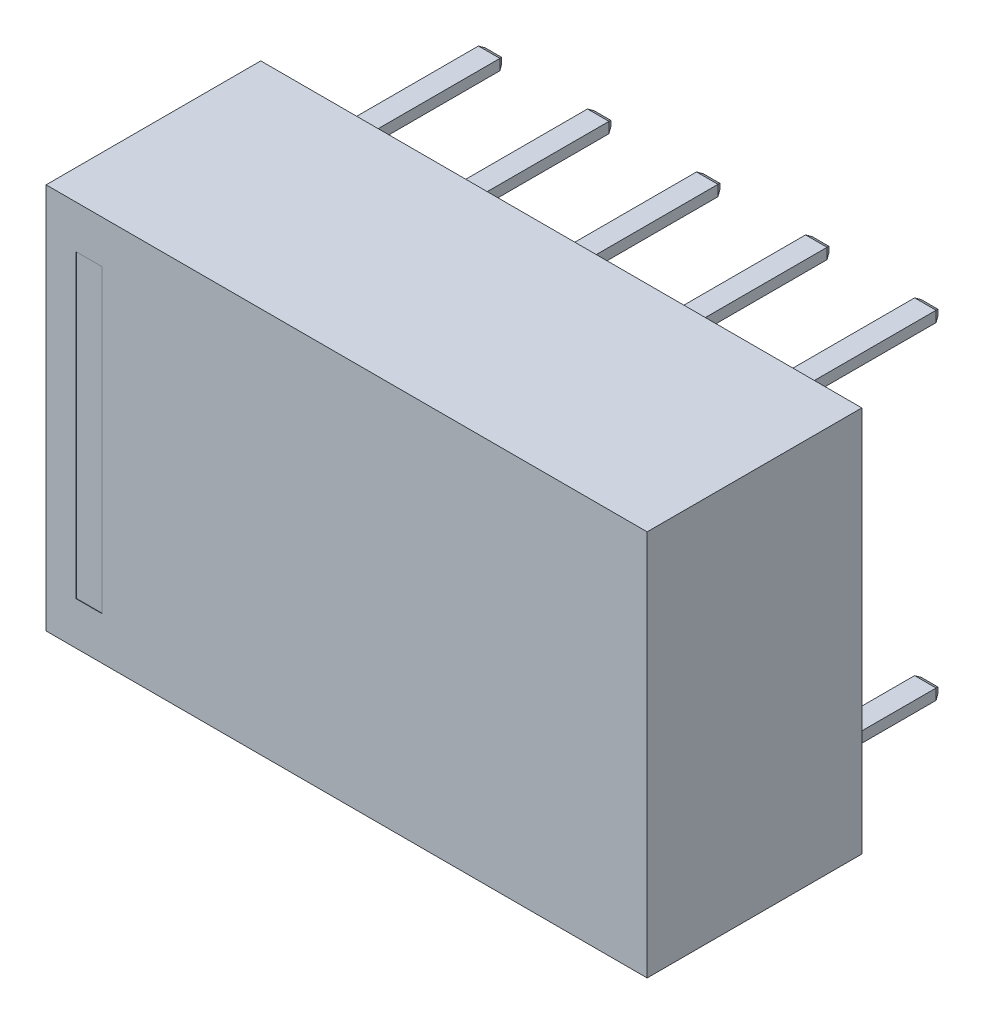
from build123d import *
from OCP.BRepFilletAPI import BRepFilletAPI_MakeChamfer

# Parameters (mm, degrees)
SKETCH_1_W                          = 14
SKETCH_1_H                          = 9
EXTRUDE_1_DEPTH                     = 5
SKETCH_3_W                          = 0.6
SKETCH_3_H                          = 7
CUT_EXTRUDE_1_DEPTH                 = 0.01
SKETCH_4_W                          = 0.5
SKETCH_4_H                          = 0.25
EXTRUDE_2_DEPTH                     = 3.5
CHAMFER_1_SIZE                      = 0.1
CHAMFER_1_SIZE2                     = 0.057735027
PATTERN_LINEAR_1_COUNT              = 5
PATTERN_LINEAR_1_PITCH              = 2.54
PATTERN_LINEAR_1_COUNT_DIR2         = 2
PATTERN_LINEAR_1_PITCH_DIR2         = 7.62
CHAMFER_1_OF_PATTERN_LINEAR_1_SIZE  = 0.1
CHAMFER_1_OF_PATTERN_LINEAR_1_SIZE2 = 0.057735027


with BuildPart() as part:
    # Эскиз1 → Бобышка-Вытянуть1 (new body)
    with BuildSketch(Plane.XY):
        Rectangle(SKETCH_1_W, SKETCH_1_H)
    extrude(amount=EXTRUDE_1_DEPTH)

    # Эскиз3 → Вырез-Вытянуть1 (cut)
    with BuildSketch(Plane.XY.offset(5)):
        with Locations((-6, 0)):
            Rectangle(SKETCH_3_W, SKETCH_3_H)
    extrude(amount=-CUT_EXTRUDE_1_DEPTH, mode=Mode.SUBTRACT)

    # Эскиз4 → Бобышка-Вытянуть2 (add)
    with BuildSketch(Plane(origin=(0, 0, 0), x_dir=(-1, 0, 0), z_dir=(0, 0, -1))):
        with Locations((5.08, -3.81)):
            Rectangle(SKETCH_4_W, SKETCH_4_H)
    extrude_2 = extrude(amount=EXTRUDE_2_DEPTH)

    # Фаска1: one chamfer whose edges measure the first distance from different faces: ONE call of the kernel's chamfer builder (chamfer() names one face for all edges)
    chamfer_1_edges_1 = [part.edges().sort_by_distance(p)[0] for p in [
        (-4.83, -3.81, -3.5),
    ]]
    chamfer_1_side_1 = [part.faces().sort_by_distance(p)[0] for p in [
        (-4.83, -3.81, -1.75),
    ]]
    chamfer_1_edges_2 = [part.edges().sort_by_distance(p)[0] for p in [
        (-5.08, -3.935, -3.5),
    ]]
    chamfer_1_side_2 = [part.faces().sort_by_distance(p)[0] for p in [
        (-5.08, -3.935, -1.75),
    ]]
    chamfer_1_edges_3 = [part.edges().sort_by_distance(p)[0] for p in [
        (-5.33, -3.81, -3.5),
    ]]
    chamfer_1_side_3 = [part.faces().sort_by_distance(p)[0] for p in [
        (-5.33, -3.81, -1.75),
    ]]
    chamfer_1_edges_4 = [part.edges().sort_by_distance(p)[0] for p in [
        (-5.08, -3.685, -3.5),
    ]]
    chamfer_1_side_4 = [part.faces().sort_by_distance(p)[0] for p in [
        (-5.08, -3.685, -1.75),
    ]]
    chamfer_1 = BRepFilletAPI_MakeChamfer(part.part.solid().wrapped)
    for e in chamfer_1_edges_1:
        chamfer_1.Add(CHAMFER_1_SIZE, CHAMFER_1_SIZE2, e.wrapped, chamfer_1_side_1[0].wrapped)  # the first distance lies on this face
    for e in chamfer_1_edges_2:
        chamfer_1.Add(CHAMFER_1_SIZE, CHAMFER_1_SIZE2, e.wrapped, chamfer_1_side_2[0].wrapped)  # the first distance lies on this face
    for e in chamfer_1_edges_3:
        chamfer_1.Add(CHAMFER_1_SIZE, CHAMFER_1_SIZE2, e.wrapped, chamfer_1_side_3[0].wrapped)  # the first distance lies on this face
    for e in chamfer_1_edges_4:
        chamfer_1.Add(CHAMFER_1_SIZE, CHAMFER_1_SIZE2, e.wrapped, chamfer_1_side_4[0].wrapped)  # the first distance lies on this face
    add(Compound.cast(chamfer_1.Shape()), mode=Mode.REPLACE)

    # Линейный массив1: Extrude 2 5 × 2
    with Locations(*[(i * PATTERN_LINEAR_1_PITCH, j * PATTERN_LINEAR_1_PITCH_DIR2, 0) for i in range(PATTERN_LINEAR_1_COUNT) for j in range(PATTERN_LINEAR_1_COUNT_DIR2) if (i, j) != (0, 0)]):
        add(extrude_2)

    # Фаска1 of Линейный массив1: one chamfer whose edges measure the first distance from different faces: ONE call of the kernel's chamfer builder (chamfer() names one face for all edges)
    chamfer_1_of_pattern_linear_1_edges_1 = [part.edges().sort_by_distance(p)[0] for p in [
        (-4.83, 3.81, -3.5),
    ]]
    chamfer_1_of_pattern_linear_1_side_1 = [part.faces().sort_by_distance(p)[0] for p in [
        (-4.83, 3.81, -1.75),
    ]]
    chamfer_1_of_pattern_linear_1_edges_2 = [part.edges().sort_by_distance(p)[0] for p in [
        (-5.08, 3.685, -3.5),
    ]]
    chamfer_1_of_pattern_linear_1_side_2 = [part.faces().sort_by_distance(p)[0] for p in [
        (-5.08, 3.685, -1.75),
    ]]
    chamfer_1_of_pattern_linear_1_edges_3 = [part.edges().sort_by_distance(p)[0] for p in [
        (-5.33, 3.81, -3.5),
    ]]
    chamfer_1_of_pattern_linear_1_side_3 = [part.faces().sort_by_distance(p)[0] for p in [
        (-5.33, 3.81, -1.75),
    ]]
    chamfer_1_of_pattern_linear_1_edges_4 = [part.edges().sort_by_distance(p)[0] for p in [
        (-5.08, 3.935, -3.5),
    ]]
    chamfer_1_of_pattern_linear_1_side_4 = [part.faces().sort_by_distance(p)[0] for p in [
        (-5.08, 3.935, -1.75),
    ]]
    chamfer_1_of_pattern_linear_1_edges_5 = [part.edges().sort_by_distance(p)[0] for p in [
        (-2.29, -3.81, -3.5),
    ]]
    chamfer_1_of_pattern_linear_1_side_5 = [part.faces().sort_by_distance(p)[0] for p in [
        (-2.29, -3.81, -1.75),
    ]]
    chamfer_1_of_pattern_linear_1_edges_6 = [part.edges().sort_by_distance(p)[0] for p in [
        (-2.54, -3.935, -3.5),
    ]]
    chamfer_1_of_pattern_linear_1_side_6 = [part.faces().sort_by_distance(p)[0] for p in [
        (-2.54, -3.935, -1.75),
    ]]
    chamfer_1_of_pattern_linear_1_edges_7 = [part.edges().sort_by_distance(p)[0] for p in [
        (-2.79, -3.81, -3.5),
    ]]
    chamfer_1_of_pattern_linear_1_side_7 = [part.faces().sort_by_distance(p)[0] for p in [
        (-2.79, -3.81, -1.75),
    ]]
    chamfer_1_of_pattern_linear_1_edges_8 = [part.edges().sort_by_distance(p)[0] for p in [
        (-2.54, -3.685, -3.5),
    ]]
    chamfer_1_of_pattern_linear_1_side_8 = [part.faces().sort_by_distance(p)[0] for p in [
        (-2.54, -3.685, -1.75),
    ]]
    chamfer_1_of_pattern_linear_1_edges_9 = [part.edges().sort_by_distance(p)[0] for p in [
        (-2.29, 3.81, -3.5),
    ]]
    chamfer_1_of_pattern_linear_1_side_9 = [part.faces().sort_by_distance(p)[0] for p in [
        (-2.29, 3.81, -1.75),
    ]]
    chamfer_1_of_pattern_linear_1_edges_10 = [part.edges().sort_by_distance(p)[0] for p in [
        (-2.54, 3.685, -3.5),
    ]]
    chamfer_1_of_pattern_linear_1_side_10 = [part.faces().sort_by_distance(p)[0] for p in [
        (-2.54, 3.685, -1.75),
    ]]
    chamfer_1_of_pattern_linear_1_edges_11 = [part.edges().sort_by_distance(p)[0] for p in [
        (-2.79, 3.81, -3.5),
    ]]
    chamfer_1_of_pattern_linear_1_side_11 = [part.faces().sort_by_distance(p)[0] for p in [
        (-2.79, 3.81, -1.75),
    ]]
    chamfer_1_of_pattern_linear_1_edges_12 = [part.edges().sort_by_distance(p)[0] for p in [
        (-2.54, 3.935, -3.5),
    ]]
    chamfer_1_of_pattern_linear_1_side_12 = [part.faces().sort_by_distance(p)[0] for p in [
        (-2.54, 3.935, -1.75),
    ]]
    chamfer_1_of_pattern_linear_1_edges_13 = [part.edges().sort_by_distance(p)[0] for p in [
        (0.25, -3.81, -3.5),
    ]]
    chamfer_1_of_pattern_linear_1_side_13 = [part.faces().sort_by_distance(p)[0] for p in [
        (0.25, -3.81, -1.75),
    ]]
    chamfer_1_of_pattern_linear_1_edges_14 = [part.edges().sort_by_distance(p)[0] for p in [
        (0, -3.935, -3.5),
    ]]
    chamfer_1_of_pattern_linear_1_side_14 = [part.faces().sort_by_distance(p)[0] for p in [
        (0, -3.935, -1.75),
    ]]
    chamfer_1_of_pattern_linear_1_edges_15 = [part.edges().sort_by_distance(p)[0] for p in [
        (-0.25, -3.81, -3.5),
    ]]
    chamfer_1_of_pattern_linear_1_side_15 = [part.faces().sort_by_distance(p)[0] for p in [
        (-0.25, -3.81, -1.75),
    ]]
    chamfer_1_of_pattern_linear_1_edges_16 = [part.edges().sort_by_distance(p)[0] for p in [
        (0, -3.685, -3.5),
    ]]
    chamfer_1_of_pattern_linear_1_side_16 = [part.faces().sort_by_distance(p)[0] for p in [
        (0, -3.685, -1.75),
    ]]
    chamfer_1_of_pattern_linear_1_edges_17 = [part.edges().sort_by_distance(p)[0] for p in [
        (0.25, 3.81, -3.5),
    ]]
    chamfer_1_of_pattern_linear_1_side_17 = [part.faces().sort_by_distance(p)[0] for p in [
        (0.25, 3.81, -1.75),
    ]]
    chamfer_1_of_pattern_linear_1_edges_18 = [part.edges().sort_by_distance(p)[0] for p in [
        (0, 3.685, -3.5),
    ]]
    chamfer_1_of_pattern_linear_1_side_18 = [part.faces().sort_by_distance(p)[0] for p in [
        (0, 3.685, -1.75),
    ]]
    chamfer_1_of_pattern_linear_1_edges_19 = [part.edges().sort_by_distance(p)[0] for p in [
        (-0.25, 3.81, -3.5),
    ]]
    chamfer_1_of_pattern_linear_1_side_19 = [part.faces().sort_by_distance(p)[0] for p in [
        (-0.25, 3.81, -1.75),
    ]]
    chamfer_1_of_pattern_linear_1_edges_20 = [part.edges().sort_by_distance(p)[0] for p in [
        (0, 3.935, -3.5),
    ]]
    chamfer_1_of_pattern_linear_1_side_20 = [part.faces().sort_by_distance(p)[0] for p in [
        (0, 3.935, -1.75),
    ]]
    chamfer_1_of_pattern_linear_1_edges_21 = [part.edges().sort_by_distance(p)[0] for p in [
        (2.79, -3.81, -3.5),
    ]]
    chamfer_1_of_pattern_linear_1_side_21 = [part.faces().sort_by_distance(p)[0] for p in [
        (2.79, -3.81, -1.75),
    ]]
    chamfer_1_of_pattern_linear_1_edges_22 = [part.edges().sort_by_distance(p)[0] for p in [
        (2.54, -3.935, -3.5),
    ]]
    chamfer_1_of_pattern_linear_1_side_22 = [part.faces().sort_by_distance(p)[0] for p in [
        (2.54, -3.935, -1.75),
    ]]
    chamfer_1_of_pattern_linear_1_edges_23 = [part.edges().sort_by_distance(p)[0] for p in [
        (2.29, -3.81, -3.5),
    ]]
    chamfer_1_of_pattern_linear_1_side_23 = [part.faces().sort_by_distance(p)[0] for p in [
        (2.29, -3.81, -1.75),
    ]]
    chamfer_1_of_pattern_linear_1_edges_24 = [part.edges().sort_by_distance(p)[0] for p in [
        (2.54, -3.685, -3.5),
    ]]
    chamfer_1_of_pattern_linear_1_side_24 = [part.faces().sort_by_distance(p)[0] for p in [
        (2.54, -3.685, -1.75),
    ]]
    chamfer_1_of_pattern_linear_1_edges_25 = [part.edges().sort_by_distance(p)[0] for p in [
        (2.79, 3.81, -3.5),
    ]]
    chamfer_1_of_pattern_linear_1_side_25 = [part.faces().sort_by_distance(p)[0] for p in [
        (2.79, 3.81, -1.75),
    ]]
    chamfer_1_of_pattern_linear_1_edges_26 = [part.edges().sort_by_distance(p)[0] for p in [
        (2.54, 3.685, -3.5),
    ]]
    chamfer_1_of_pattern_linear_1_side_26 = [part.faces().sort_by_distance(p)[0] for p in [
        (2.54, 3.685, -1.75),
    ]]
    chamfer_1_of_pattern_linear_1_edges_27 = [part.edges().sort_by_distance(p)[0] for p in [
        (2.29, 3.81, -3.5),
    ]]
    chamfer_1_of_pattern_linear_1_side_27 = [part.faces().sort_by_distance(p)[0] for p in [
        (2.29, 3.81, -1.75),
    ]]
    chamfer_1_of_pattern_linear_1_edges_28 = [part.edges().sort_by_distance(p)[0] for p in [
        (2.54, 3.935, -3.5),
    ]]
    chamfer_1_of_pattern_linear_1_side_28 = [part.faces().sort_by_distance(p)[0] for p in [
        (2.54, 3.935, -1.75),
    ]]
    chamfer_1_of_pattern_linear_1_edges_29 = [part.edges().sort_by_distance(p)[0] for p in [
        (5.33, -3.81, -3.5),
    ]]
    chamfer_1_of_pattern_linear_1_side_29 = [part.faces().sort_by_distance(p)[0] for p in [
        (5.33, -3.81, -1.75),
    ]]
    chamfer_1_of_pattern_linear_1_edges_30 = [part.edges().sort_by_distance(p)[0] for p in [
        (5.08, -3.935, -3.5),
    ]]
    chamfer_1_of_pattern_linear_1_side_30 = [part.faces().sort_by_distance(p)[0] for p in [
        (5.08, -3.935, -1.75),
    ]]
    chamfer_1_of_pattern_linear_1_edges_31 = [part.edges().sort_by_distance(p)[0] for p in [
        (4.83, -3.81, -3.5),
    ]]
    chamfer_1_of_pattern_linear_1_side_31 = [part.faces().sort_by_distance(p)[0] for p in [
        (4.83, -3.81, -1.75),
    ]]
    chamfer_1_of_pattern_linear_1_edges_32 = [part.edges().sort_by_distance(p)[0] for p in [
        (5.08, -3.685, -3.5),
    ]]
    chamfer_1_of_pattern_linear_1_side_32 = [part.faces().sort_by_distance(p)[0] for p in [
        (5.08, -3.685, -1.75),
    ]]
    chamfer_1_of_pattern_linear_1_edges_33 = [part.edges().sort_by_distance(p)[0] for p in [
        (5.33, 3.81, -3.5),
    ]]
    chamfer_1_of_pattern_linear_1_side_33 = [part.faces().sort_by_distance(p)[0] for p in [
        (5.33, 3.81, -1.75),
    ]]
    chamfer_1_of_pattern_linear_1_edges_34 = [part.edges().sort_by_distance(p)[0] for p in [
        (5.08, 3.685, -3.5),
    ]]
    chamfer_1_of_pattern_linear_1_side_34 = [part.faces().sort_by_distance(p)[0] for p in [
        (5.08, 3.685, -1.75),
    ]]
    chamfer_1_of_pattern_linear_1_edges_35 = [part.edges().sort_by_distance(p)[0] for p in [
        (4.83, 3.81, -3.5),
    ]]
    chamfer_1_of_pattern_linear_1_side_35 = [part.faces().sort_by_distance(p)[0] for p in [
        (4.83, 3.81, -1.75),
    ]]
    chamfer_1_of_pattern_linear_1_edges_36 = [part.edges().sort_by_distance(p)[0] for p in [
        (5.08, 3.935, -3.5),
    ]]
    chamfer_1_of_pattern_linear_1_side_36 = [part.faces().sort_by_distance(p)[0] for p in [
        (5.08, 3.935, -1.75),
    ]]
    chamfer_1_of_pattern_linear_1 = BRepFilletAPI_MakeChamfer(part.part.solid().wrapped)
    for e in chamfer_1_of_pattern_linear_1_edges_1:
        chamfer_1_of_pattern_linear_1.Add(CHAMFER_1_OF_PATTERN_LINEAR_1_SIZE, CHAMFER_1_OF_PATTERN_LINEAR_1_SIZE2, e.wrapped, chamfer_1_of_pattern_linear_1_side_1[0].wrapped)  # the first distance lies on this face
    for e in chamfer_1_of_pattern_linear_1_edges_2:
        chamfer_1_of_pattern_linear_1.Add(CHAMFER_1_OF_PATTERN_LINEAR_1_SIZE, CHAMFER_1_OF_PATTERN_LINEAR_1_SIZE2, e.wrapped, chamfer_1_of_pattern_linear_1_side_2[0].wrapped)  # the first distance lies on this face
    for e in chamfer_1_of_pattern_linear_1_edges_3:
        chamfer_1_of_pattern_linear_1.Add(CHAMFER_1_OF_PATTERN_LINEAR_1_SIZE, CHAMFER_1_OF_PATTERN_LINEAR_1_SIZE2, e.wrapped, chamfer_1_of_pattern_linear_1_side_3[0].wrapped)  # the first distance lies on this face
    for e in chamfer_1_of_pattern_linear_1_edges_4:
        chamfer_1_of_pattern_linear_1.Add(CHAMFER_1_OF_PATTERN_LINEAR_1_SIZE, CHAMFER_1_OF_PATTERN_LINEAR_1_SIZE2, e.wrapped, chamfer_1_of_pattern_linear_1_side_4[0].wrapped)  # the first distance lies on this face
    for e in chamfer_1_of_pattern_linear_1_edges_5:
        chamfer_1_of_pattern_linear_1.Add(CHAMFER_1_OF_PATTERN_LINEAR_1_SIZE, CHAMFER_1_OF_PATTERN_LINEAR_1_SIZE2, e.wrapped, chamfer_1_of_pattern_linear_1_side_5[0].wrapped)  # the first distance lies on this face
    for e in chamfer_1_of_pattern_linear_1_edges_6:
        chamfer_1_of_pattern_linear_1.Add(CHAMFER_1_OF_PATTERN_LINEAR_1_SIZE, CHAMFER_1_OF_PATTERN_LINEAR_1_SIZE2, e.wrapped, chamfer_1_of_pattern_linear_1_side_6[0].wrapped)  # the first distance lies on this face
    for e in chamfer_1_of_pattern_linear_1_edges_7:
        chamfer_1_of_pattern_linear_1.Add(CHAMFER_1_OF_PATTERN_LINEAR_1_SIZE, CHAMFER_1_OF_PATTERN_LINEAR_1_SIZE2, e.wrapped, chamfer_1_of_pattern_linear_1_side_7[0].wrapped)  # the first distance lies on this face
    for e in chamfer_1_of_pattern_linear_1_edges_8:
        chamfer_1_of_pattern_linear_1.Add(CHAMFER_1_OF_PATTERN_LINEAR_1_SIZE, CHAMFER_1_OF_PATTERN_LINEAR_1_SIZE2, e.wrapped, chamfer_1_of_pattern_linear_1_side_8[0].wrapped)  # the first distance lies on this face
    for e in chamfer_1_of_pattern_linear_1_edges_9:
        chamfer_1_of_pattern_linear_1.Add(CHAMFER_1_OF_PATTERN_LINEAR_1_SIZE, CHAMFER_1_OF_PATTERN_LINEAR_1_SIZE2, e.wrapped, chamfer_1_of_pattern_linear_1_side_9[0].wrapped)  # the first distance lies on this face
    for e in chamfer_1_of_pattern_linear_1_edges_10:
        chamfer_1_of_pattern_linear_1.Add(CHAMFER_1_OF_PATTERN_LINEAR_1_SIZE, CHAMFER_1_OF_PATTERN_LINEAR_1_SIZE2, e.wrapped, chamfer_1_of_pattern_linear_1_side_10[0].wrapped)  # the first distance lies on this face
    for e in chamfer_1_of_pattern_linear_1_edges_11:
        chamfer_1_of_pattern_linear_1.Add(CHAMFER_1_OF_PATTERN_LINEAR_1_SIZE, CHAMFER_1_OF_PATTERN_LINEAR_1_SIZE2, e.wrapped, chamfer_1_of_pattern_linear_1_side_11[0].wrapped)  # the first distance lies on this face
    for e in chamfer_1_of_pattern_linear_1_edges_12:
        chamfer_1_of_pattern_linear_1.Add(CHAMFER_1_OF_PATTERN_LINEAR_1_SIZE, CHAMFER_1_OF_PATTERN_LINEAR_1_SIZE2, e.wrapped, chamfer_1_of_pattern_linear_1_side_12[0].wrapped)  # the first distance lies on this face
    for e in chamfer_1_of_pattern_linear_1_edges_13:
        chamfer_1_of_pattern_linear_1.Add(CHAMFER_1_OF_PATTERN_LINEAR_1_SIZE, CHAMFER_1_OF_PATTERN_LINEAR_1_SIZE2, e.wrapped, chamfer_1_of_pattern_linear_1_side_13[0].wrapped)  # the first distance lies on this face
    for e in chamfer_1_of_pattern_linear_1_edges_14:
        chamfer_1_of_pattern_linear_1.Add(CHAMFER_1_OF_PATTERN_LINEAR_1_SIZE, CHAMFER_1_OF_PATTERN_LINEAR_1_SIZE2, e.wrapped, chamfer_1_of_pattern_linear_1_side_14[0].wrapped)  # the first distance lies on this face
    for e in chamfer_1_of_pattern_linear_1_edges_15:
        chamfer_1_of_pattern_linear_1.Add(CHAMFER_1_OF_PATTERN_LINEAR_1_SIZE, CHAMFER_1_OF_PATTERN_LINEAR_1_SIZE2, e.wrapped, chamfer_1_of_pattern_linear_1_side_15[0].wrapped)  # the first distance lies on this face
    for e in chamfer_1_of_pattern_linear_1_edges_16:
        chamfer_1_of_pattern_linear_1.Add(CHAMFER_1_OF_PATTERN_LINEAR_1_SIZE, CHAMFER_1_OF_PATTERN_LINEAR_1_SIZE2, e.wrapped, chamfer_1_of_pattern_linear_1_side_16[0].wrapped)  # the first distance lies on this face
    for e in chamfer_1_of_pattern_linear_1_edges_17:
        chamfer_1_of_pattern_linear_1.Add(CHAMFER_1_OF_PATTERN_LINEAR_1_SIZE, CHAMFER_1_OF_PATTERN_LINEAR_1_SIZE2, e.wrapped, chamfer_1_of_pattern_linear_1_side_17[0].wrapped)  # the first distance lies on this face
    for e in chamfer_1_of_pattern_linear_1_edges_18:
        chamfer_1_of_pattern_linear_1.Add(CHAMFER_1_OF_PATTERN_LINEAR_1_SIZE, CHAMFER_1_OF_PATTERN_LINEAR_1_SIZE2, e.wrapped, chamfer_1_of_pattern_linear_1_side_18[0].wrapped)  # the first distance lies on this face
    for e in chamfer_1_of_pattern_linear_1_edges_19:
        chamfer_1_of_pattern_linear_1.Add(CHAMFER_1_OF_PATTERN_LINEAR_1_SIZE, CHAMFER_1_OF_PATTERN_LINEAR_1_SIZE2, e.wrapped, chamfer_1_of_pattern_linear_1_side_19[0].wrapped)  # the first distance lies on this face
    for e in chamfer_1_of_pattern_linear_1_edges_20:
        chamfer_1_of_pattern_linear_1.Add(CHAMFER_1_OF_PATTERN_LINEAR_1_SIZE, CHAMFER_1_OF_PATTERN_LINEAR_1_SIZE2, e.wrapped, chamfer_1_of_pattern_linear_1_side_20[0].wrapped)  # the first distance lies on this face
    for e in chamfer_1_of_pattern_linear_1_edges_21:
        chamfer_1_of_pattern_linear_1.Add(CHAMFER_1_OF_PATTERN_LINEAR_1_SIZE, CHAMFER_1_OF_PATTERN_LINEAR_1_SIZE2, e.wrapped, chamfer_1_of_pattern_linear_1_side_21[0].wrapped)  # the first distance lies on this face
    for e in chamfer_1_of_pattern_linear_1_edges_22:
        chamfer_1_of_pattern_linear_1.Add(CHAMFER_1_OF_PATTERN_LINEAR_1_SIZE, CHAMFER_1_OF_PATTERN_LINEAR_1_SIZE2, e.wrapped, chamfer_1_of_pattern_linear_1_side_22[0].wrapped)  # the first distance lies on this face
    for e in chamfer_1_of_pattern_linear_1_edges_23:
        chamfer_1_of_pattern_linear_1.Add(CHAMFER_1_OF_PATTERN_LINEAR_1_SIZE, CHAMFER_1_OF_PATTERN_LINEAR_1_SIZE2, e.wrapped, chamfer_1_of_pattern_linear_1_side_23[0].wrapped)  # the first distance lies on this face
    for e in chamfer_1_of_pattern_linear_1_edges_24:
        chamfer_1_of_pattern_linear_1.Add(CHAMFER_1_OF_PATTERN_LINEAR_1_SIZE, CHAMFER_1_OF_PATTERN_LINEAR_1_SIZE2, e.wrapped, chamfer_1_of_pattern_linear_1_side_24[0].wrapped)  # the first distance lies on this face
    for e in chamfer_1_of_pattern_linear_1_edges_25:
        chamfer_1_of_pattern_linear_1.Add(CHAMFER_1_OF_PATTERN_LINEAR_1_SIZE, CHAMFER_1_OF_PATTERN_LINEAR_1_SIZE2, e.wrapped, chamfer_1_of_pattern_linear_1_side_25[0].wrapped)  # the first distance lies on this face
    for e in chamfer_1_of_pattern_linear_1_edges_26:
        chamfer_1_of_pattern_linear_1.Add(CHAMFER_1_OF_PATTERN_LINEAR_1_SIZE, CHAMFER_1_OF_PATTERN_LINEAR_1_SIZE2, e.wrapped, chamfer_1_of_pattern_linear_1_side_26[0].wrapped)  # the first distance lies on this face
    for e in chamfer_1_of_pattern_linear_1_edges_27:
        chamfer_1_of_pattern_linear_1.Add(CHAMFER_1_OF_PATTERN_LINEAR_1_SIZE, CHAMFER_1_OF_PATTERN_LINEAR_1_SIZE2, e.wrapped, chamfer_1_of_pattern_linear_1_side_27[0].wrapped)  # the first distance lies on this face
    for e in chamfer_1_of_pattern_linear_1_edges_28:
        chamfer_1_of_pattern_linear_1.Add(CHAMFER_1_OF_PATTERN_LINEAR_1_SIZE, CHAMFER_1_OF_PATTERN_LINEAR_1_SIZE2, e.wrapped, chamfer_1_of_pattern_linear_1_side_28[0].wrapped)  # the first distance lies on this face
    for e in chamfer_1_of_pattern_linear_1_edges_29:
        chamfer_1_of_pattern_linear_1.Add(CHAMFER_1_OF_PATTERN_LINEAR_1_SIZE, CHAMFER_1_OF_PATTERN_LINEAR_1_SIZE2, e.wrapped, chamfer_1_of_pattern_linear_1_side_29[0].wrapped)  # the first distance lies on this face
    for e in chamfer_1_of_pattern_linear_1_edges_30:
        chamfer_1_of_pattern_linear_1.Add(CHAMFER_1_OF_PATTERN_LINEAR_1_SIZE, CHAMFER_1_OF_PATTERN_LINEAR_1_SIZE2, e.wrapped, chamfer_1_of_pattern_linear_1_side_30[0].wrapped)  # the first distance lies on this face
    for e in chamfer_1_of_pattern_linear_1_edges_31:
        chamfer_1_of_pattern_linear_1.Add(CHAMFER_1_OF_PATTERN_LINEAR_1_SIZE, CHAMFER_1_OF_PATTERN_LINEAR_1_SIZE2, e.wrapped, chamfer_1_of_pattern_linear_1_side_31[0].wrapped)  # the first distance lies on this face
    for e in chamfer_1_of_pattern_linear_1_edges_32:
        chamfer_1_of_pattern_linear_1.Add(CHAMFER_1_OF_PATTERN_LINEAR_1_SIZE, CHAMFER_1_OF_PATTERN_LINEAR_1_SIZE2, e.wrapped, chamfer_1_of_pattern_linear_1_side_32[0].wrapped)  # the first distance lies on this face
    for e in chamfer_1_of_pattern_linear_1_edges_33:
        chamfer_1_of_pattern_linear_1.Add(CHAMFER_1_OF_PATTERN_LINEAR_1_SIZE, CHAMFER_1_OF_PATTERN_LINEAR_1_SIZE2, e.wrapped, chamfer_1_of_pattern_linear_1_side_33[0].wrapped)  # the first distance lies on this face
    for e in chamfer_1_of_pattern_linear_1_edges_34:
        chamfer_1_of_pattern_linear_1.Add(CHAMFER_1_OF_PATTERN_LINEAR_1_SIZE, CHAMFER_1_OF_PATTERN_LINEAR_1_SIZE2, e.wrapped, chamfer_1_of_pattern_linear_1_side_34[0].wrapped)  # the first distance lies on this face
    for e in chamfer_1_of_pattern_linear_1_edges_35:
        chamfer_1_of_pattern_linear_1.Add(CHAMFER_1_OF_PATTERN_LINEAR_1_SIZE, CHAMFER_1_OF_PATTERN_LINEAR_1_SIZE2, e.wrapped, chamfer_1_of_pattern_linear_1_side_35[0].wrapped)  # the first distance lies on this face
    for e in chamfer_1_of_pattern_linear_1_edges_36:
        chamfer_1_of_pattern_linear_1.Add(CHAMFER_1_OF_PATTERN_LINEAR_1_SIZE, CHAMFER_1_OF_PATTERN_LINEAR_1_SIZE2, e.wrapped, chamfer_1_of_pattern_linear_1_side_36[0].wrapped)  # the first distance lies on this face
    add(Compound.cast(chamfer_1_of_pattern_linear_1.Shape()), mode=Mode.REPLACE)


solid = part.part
